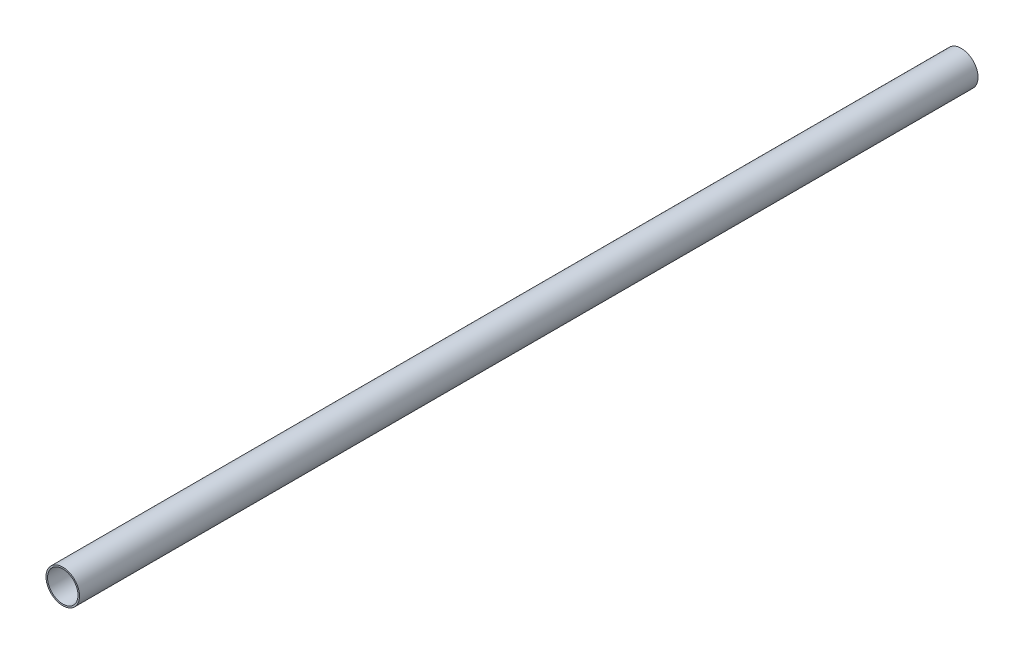
from build123d import *

# Parameters (mm, degrees)
SKETCH1_R           = 27.94
SKETCH1_R_2         = 25.4
BOSS_EXTRUDE1_DEPTH = 1498.6


with BuildPart() as part:
    # Sketch1 → Boss-Extrude1 (new body)
    with BuildSketch(Plane.XY):
        with Locations(Location((0, 0, 0), (0, 0, 180))):
            Circle(SKETCH1_R)
        with Locations(Location((0, 0, 0), (0, 0, 180))):
            Circle(SKETCH1_R_2, mode=Mode.SUBTRACT)
    extrude(amount=BOSS_EXTRUDE1_DEPTH)


solid = part.part
